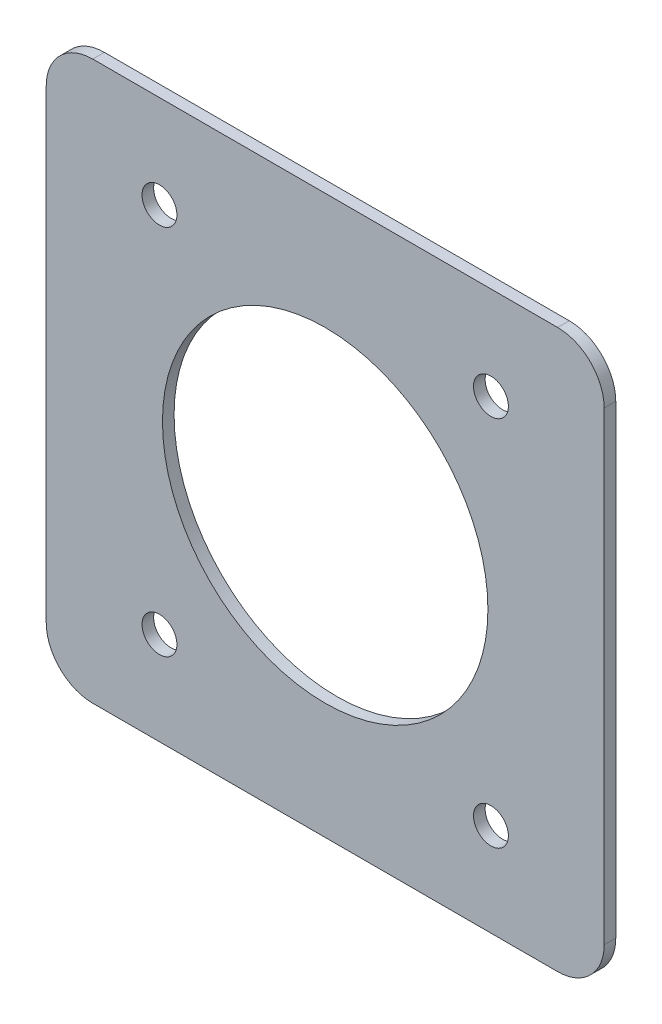
from build123d import *

# Parameters (mm, degrees)
SKETCH1_R           = 4.7625
BOSS_EXTRUDE1_DEPTH = 3.175
SKETCH2_R           = 44.45
CUT_EXTRUDE1_DEPTH  = 287.434302847


with BuildPart() as part:
    # Sketch1 → Boss-Extrude1 (new body)
    with BuildSketch(Plane.XY):
        with BuildLine():
            Line((-230.997719316, 150.485716341), (-103.997719316, 150.485716341))
            ThreePointArc((-103.997719316, 150.485716341), (-95.017463195, 146.765972462), (-91.297719316, 137.785716341))
            Line((-91.297719316, 137.785716341), (-91.297719316, 10.785716341))
            ThreePointArc((-91.297719316, 10.785716341), (-95.017463195, 1.80546022), (-103.997719316, -1.914283659))
            Line((-103.997719316, -1.914283659), (-230.997719316, -1.914283659))
            ThreePointArc((-230.997719316, -1.914283659), (-239.977975437, 1.80546022), (-243.697719316, 10.785716341))
            Line((-243.697719316, 10.785716341), (-243.697719316, 137.785716341))
            ThreePointArc((-243.697719316, 137.785716341), (-239.977975437, 146.765972462), (-230.997719316, 150.485716341))
        make_face()
        with Locations((-122.222219316, 125.085716341)):
            Circle(SKETCH1_R, mode=Mode.SUBTRACT)
        with Locations((-212.773219316, 125.085716341)):
            Circle(SKETCH1_R, mode=Mode.SUBTRACT)
        with Locations((-212.773219316, 23.485716341)):
            Circle(SKETCH1_R, mode=Mode.SUBTRACT)
        with Locations((-122.222219316, 23.485716341)):
            Circle(SKETCH1_R, mode=Mode.SUBTRACT)
    extrude(amount=BOSS_EXTRUDE1_DEPTH)

    # Sketch2 → Cut-Extrude1 (cut, through all)
    with BuildSketch(Plane.XY.offset(3.175)):
        with Locations((-167.497719316, 74.285716341)):
            Circle(SKETCH2_R)
    extrude(amount=-CUT_EXTRUDE1_DEPTH, mode=Mode.SUBTRACT)


solid = part.part
